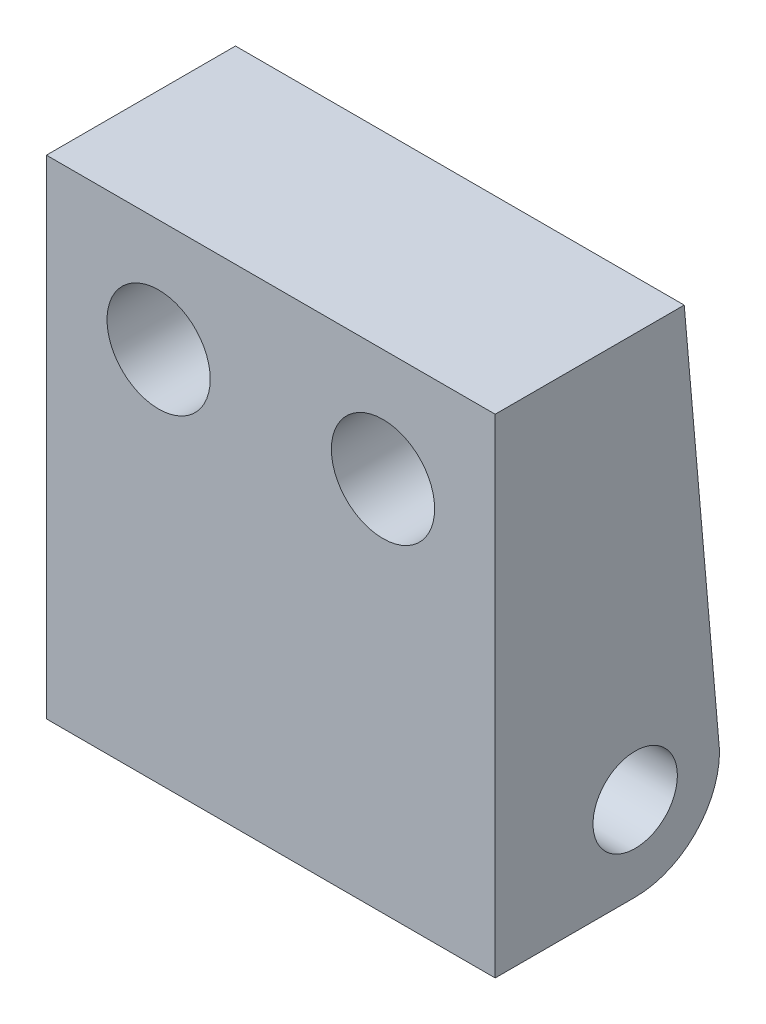
from build123d import *

# Parameters (mm, degrees)
SKETCH2_W           = 12.7
SKETCH2_H           = 13.8176
BOSS_EXTRUDE1_DEPTH = 6.35
SKETCH4_R           = 1.1938
CUT_EXTRUDE1_DEPTH  = 20.812586145
CUT_EXTRUDE2_DEPTH  = 20.812586145
SKETCH8_R           = 1.4605
CUT_EXTRUDE3_DEPTH  = 20.812586145
SKETCH9_R           = 2.7813
CUT_EXTRUDE4_DEPTH  = 20.442799947


with BuildPart() as part:
    # Sketch2 → Boss-Extrude1 (new body)
    with BuildSketch(Plane.XY):
        with Locations((6.35, 6.9088)):
            Rectangle(SKETCH2_W, SKETCH2_H)
    extrude(amount=BOSS_EXTRUDE1_DEPTH)

    # Sketch4 → Cut-Extrude1 (cut, through all)
    with BuildSketch(Plane(origin=(12.7, 0, 0), x_dir=(0, 0, -1), z_dir=(1, 0, 0))):
        with Locations((-2.3876, 2.3876)):
            Circle(SKETCH4_R)
        with BuildLine():
            Line((0, 2.3876), (2.839420075, 2.3876))
            Line((2.839420075, 2.3876), (2.839420075, -2.482839526))
            Line((2.839420075, -2.482839526), (-2.3876, -2.482839526))
            Line((-2.3876, -2.482839526), (-2.3876, 0))
            ThreePointArc((-2.3876, 0), (-0.699311849, 0.699311849), (0, 2.3876))
        make_face()
    extrude(amount=-CUT_EXTRUDE1_DEPTH, mode=Mode.SUBTRACT)

    # Sketch7 → Cut-Extrude2 (cut, through all)
    with BuildSketch(Plane(origin=(12.7, 0, 0), x_dir=(0, 0, -1), z_dir=(1, 0, 0))):
        Polygon((0, 2.3876), (-1.031425935, 14.176852388), (1.156682431, 14.176852388), (1.156682431, 2.3876), align=None)
    extrude(amount=-CUT_EXTRUDE2_DEPTH, mode=Mode.SUBTRACT)

    # Sketch8 → Cut-Extrude3 (cut, through all)
    with BuildSketch(Plane.XY.offset(6.35)):
        with Locations((3.175, 10.6426)):
            Circle(SKETCH8_R)
        with Locations(Location((9.525, 10.6426, 0), (0, 0, 90))):
            Circle(SKETCH8_R)
    extrude(amount=-CUT_EXTRUDE3_DEPTH, mode=Mode.SUBTRACT)

    # Sketch9 → Cut-Extrude4 (cut, through all)
    with BuildSketch(Plane.XY.offset(1.27)):
        with Locations((3.175, 10.6426)):
            Circle(SKETCH9_R)
        with Locations((9.525, 10.6426)):
            Circle(SKETCH9_R)
    extrude(amount=-CUT_EXTRUDE4_DEPTH, mode=Mode.SUBTRACT)


solid = part.part
